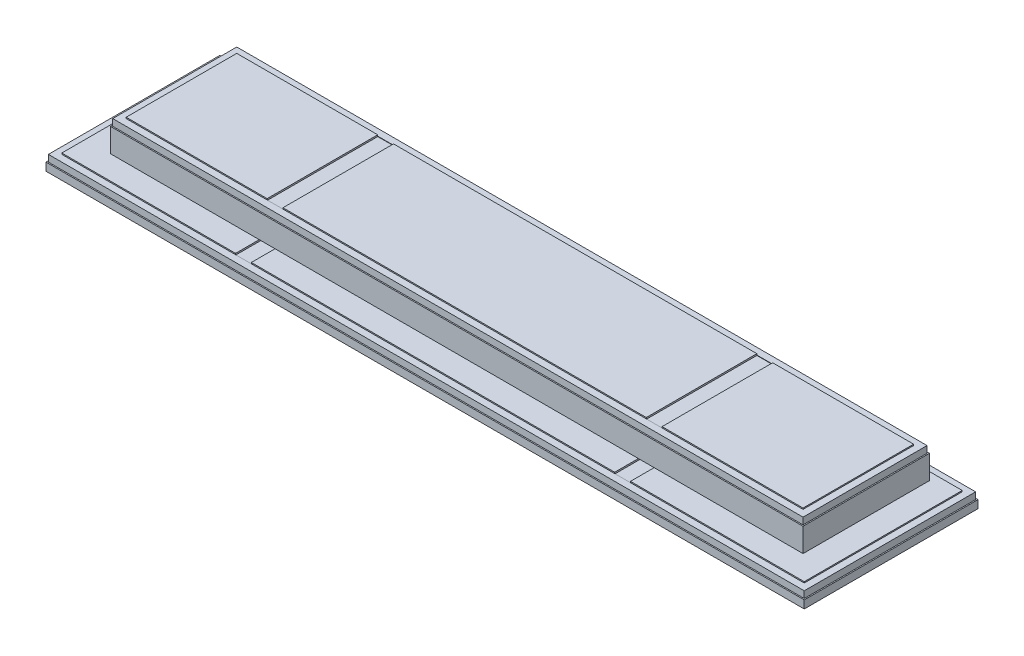
from build123d import *

# Parameters (mm, degrees)
SKETCH1_W           = 1920
SKETCH1_H           = 440
BOSS_EXTRUDE1_DEPTH = 40
SKETCH4_W           = 1754
SKETCH4_H           = 320
BOSS_EXTRUDE2_DEPTH = 80
SKETCH5_W           = 1754
SKETCH5_H           = 320
SKETCH5_W_2         = 1714
SKETCH5_H_2         = 280
CUT_EXTRUDE1_DEPTH  = 3
SKETCH6_W           = 1754
SKETCH6_H           = 320
SKETCH6_W_2         = 1748
SKETCH6_H_2         = 314
CUT_EXTRUDE2_DEPTH  = 20
SKETCH7_W           = 40
SKETCH7_H           = 280
CUT_EXTRUDE3_DEPTH  = 4
SKETCH8_W           = 1920
SKETCH8_H           = 440
SKETCH8_W_2         = 1880
SKETCH8_H_2         = 400
CUT_EXTRUDE4_DEPTH  = 3
SKETCH9_W           = 1920
SKETCH9_H           = 440
SKETCH9_W_2         = 1914
SKETCH9_H_2         = 434
CUT_EXTRUDE5_DEPTH  = 20
SKETCH10_W          = 40
SKETCH10_H          = 400
CUT_EXTRUDE9_DEPTH  = 4


with BuildPart() as part:
    # Sketch1 → Boss-Extrude1 (new body)
    with BuildSketch(Plane(origin=(0, 0, 0), x_dir=(1, 0, 0), z_dir=(0, 1, 0))):
        with Locations((0, 10)):
            Rectangle(SKETCH1_W, SKETCH1_H)
    extrude(amount=BOSS_EXTRUDE1_DEPTH)

    # Sketch4 → Boss-Extrude2 (add)
    with BuildSketch(Plane(origin=(0, 40, 0), x_dir=(1, 0, 0), z_dir=(0, 1, 0))):
        with Locations((0, 30)):
            Rectangle(SKETCH4_W, SKETCH4_H)
    extrude(amount=BOSS_EXTRUDE2_DEPTH)

    # Sketch5 → Cut-Extrude1 (cut)
    with BuildSketch(Plane(origin=(0, 120, 0), x_dir=(1, 0, 0), z_dir=(0, 1, 0))):
        with Locations((0, 30)):
            Rectangle(SKETCH5_W, SKETCH5_H)
        with Locations((0, 30)):
            Rectangle(SKETCH5_W_2, SKETCH5_H_2, mode=Mode.SUBTRACT)
    extrude(amount=-CUT_EXTRUDE1_DEPTH, mode=Mode.SUBTRACT)

    # Sketch6 → Cut-Extrude2 (cut)
    with BuildSketch(Plane(origin=(0, 120, 0), x_dir=(1, 0, 0), z_dir=(0, 1, 0))):
        with Locations((0, 30)):
            Rectangle(SKETCH6_W, SKETCH6_H)
        with Locations((0, 30)):
            Rectangle(SKETCH6_W_2, SKETCH6_H_2, mode=Mode.SUBTRACT)
    extrude(amount=-CUT_EXTRUDE2_DEPTH, mode=Mode.SUBTRACT)

    # Sketch7 → Cut-Extrude3 (cut)
    with BuildSketch(Plane(origin=(0, 120, 0), x_dir=(1, 0, 0), z_dir=(0, 1, 0))):
        with Locations((480, 30)):
            Rectangle(SKETCH7_W, SKETCH7_H)
        with Locations((-480, 30)):
            Rectangle(SKETCH7_W, SKETCH7_H)
    extrude(amount=-CUT_EXTRUDE3_DEPTH, mode=Mode.SUBTRACT)

    # Sketch8 → Cut-Extrude4 (cut)
    with BuildSketch(Plane(origin=(0, 40, 0), x_dir=(1, 0, 0), z_dir=(0, 1, 0))):
        with Locations((0, 10)):
            Rectangle(SKETCH8_W, SKETCH8_H)
        with Locations((0, 10)):
            Rectangle(SKETCH8_W_2, SKETCH8_H_2, mode=Mode.SUBTRACT)
    extrude(amount=-CUT_EXTRUDE4_DEPTH, mode=Mode.SUBTRACT)

    # Sketch9 → Cut-Extrude5 (cut)
    with BuildSketch(Plane(origin=(0, 40, 0), x_dir=(1, 0, 0), z_dir=(0, 1, 0))):
        with Locations((0, 10)):
            Rectangle(SKETCH9_W, SKETCH9_H)
        with Locations((0, 10)):
            Rectangle(SKETCH9_W_2, SKETCH9_H_2, mode=Mode.SUBTRACT)
    extrude(amount=-CUT_EXTRUDE5_DEPTH, mode=Mode.SUBTRACT)

    # Sketch10 → Cut-Extrude9 (cut)
    with BuildSketch(Plane(origin=(0, 40, 0), x_dir=(1, 0, 0), z_dir=(0, 1, 0))):
        with Locations((-480, 10)):
            Rectangle(SKETCH10_W, SKETCH10_H)
        with Locations((480, 10)):
            Rectangle(SKETCH10_W, SKETCH10_H)
    extrude(amount=-CUT_EXTRUDE9_DEPTH, mode=Mode.SUBTRACT)


solid = part.part
